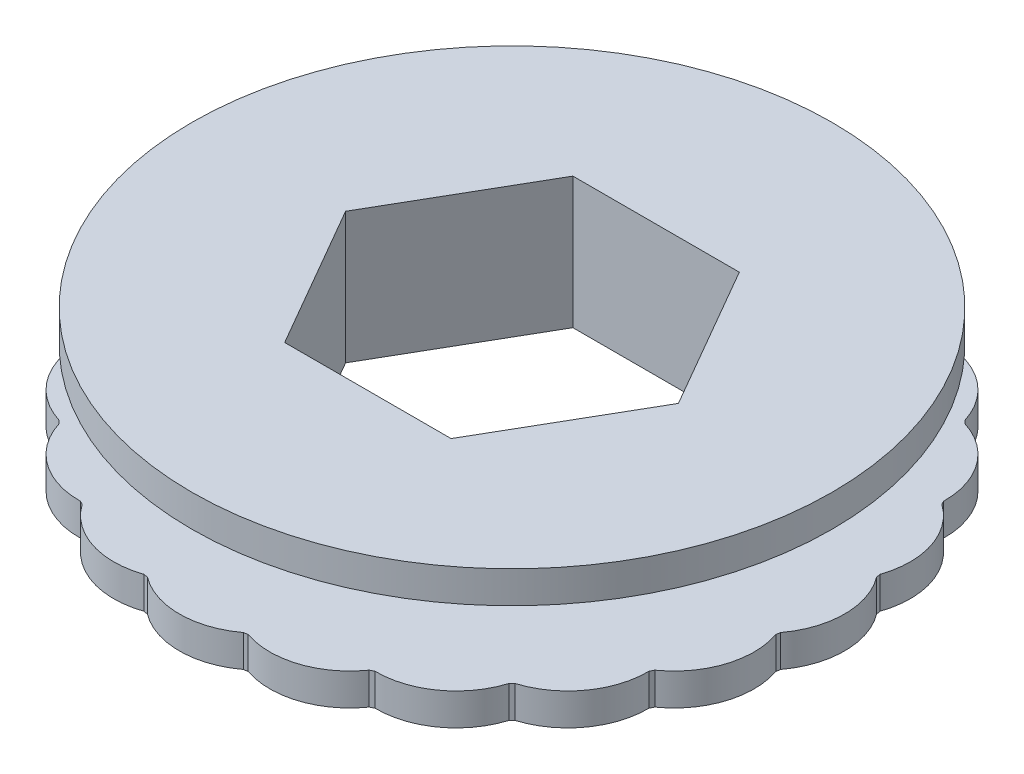
from build123d import *

# Parameters (mm, degrees)
BOSS_EXTRUDE1_DEPTH     = 0.5
CIRPATTERN3_COUNT       = 20
CUT_EXTRUDE1_DEPTH      = 8.62534786
CUT_EXTRUDE1_DEPTH_BACK = 8.62534786


with BuildPart() as part:
    # Sketch1 → Revolve1 (revolve)
    with BuildSketch(Plane(origin=(0, 0, 0), x_dir=(0, 0, -1), z_dir=(1, 0, 0))):
        Polygon((-3.5, 0.525), (-3.5, -0.525), (-5, -0.525), (-5, -1.025), (0, -1.025), (0, -0.525), (0, 0.525), (0, 1.025), (-5, 1.025), (-5, 0.525), align=None)
    revolve(axis=Axis((0, 0, 0), (0, -1, 0)))

    # Sketch3 → Boss-Extrude1 (add)
    with BuildSketch(Plane.XZ.offset(1.025)):
        with BuildLine():
            ThreePointArc((-0.75, 4.943429983), (0, 5.193429983), (0.75, 4.943429983))
            ThreePointArc((0.75, 4.943429983), (0, 5), (-0.75, 4.943429983))
        make_face()
    boss_extrude1 = extrude(amount=-BOSS_EXTRUDE1_DEPTH)

    # CirPattern3: Boss-Extrude1 ×20 about axis
    cirpattern3_axis = Axis((0, 0, 0), (0, 1, 0))
    for i in range(1, CIRPATTERN3_COUNT):
        add(boss_extrude1.rotate(cirpattern3_axis, i * 360 / CIRPATTERN3_COUNT))

    # Sketch4 → Cut-Extrude1 (cut, two sides: drawn at the far end of the back side and taken through both)
    with BuildSketch(Plane(origin=(0, 1.025, 0), x_dir=(1, 0, 0), z_dir=(0, 1, 0)).offset(-CUT_EXTRUDE1_DEPTH_BACK)):
        Polygon((1.299038106, 2.25), (-1.299038106, 2.25), (-2.598076211, 0), (-1.299038106, -2.25), (1.299038106, -2.25), (2.598076211, 0), align=None)
    extrude(amount=CUT_EXTRUDE1_DEPTH + CUT_EXTRUDE1_DEPTH_BACK, mode=Mode.SUBTRACT)


solid = part.part
